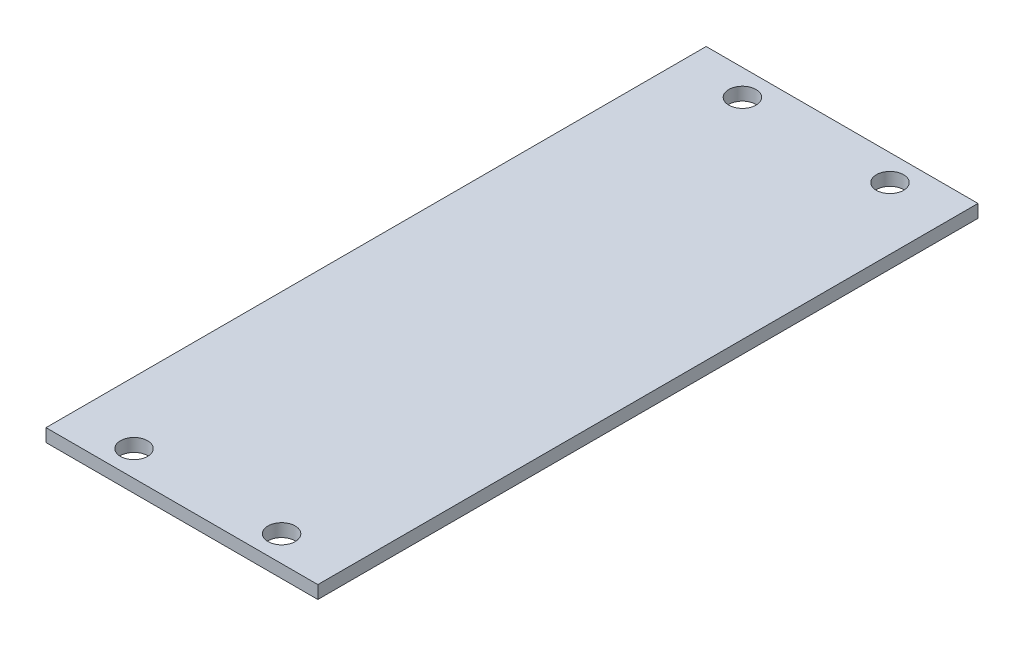
from build123d import *

# Parameters (mm, degrees)
SKETCH1_W               = 21
SKETCH1_H               = 51
BOSS_EXTRUDE1_DEPTH     = 1
SKETCH3_R               = 1.05
CUT_EXTRUDE2_DEPTH      = 28.595289453
MIRROR2_COPY_1_SKETCH_R = 1.05
MIRROR2_COPY_1_DEPTH    = 28.595289453


with BuildPart() as part:
    # Sketch1 → Boss-Extrude1 (new body)
    with BuildSketch(Plane(origin=(0, 0, 0), x_dir=(1, 0, 0), z_dir=(0, 1, 0))):
        Rectangle(SKETCH1_W, SKETCH1_H)
    extrude(amount=BOSS_EXTRUDE1_DEPTH)

    # Sketch3 → Cut-Extrude2 (cut, through all)
    with BuildSketch(Plane(origin=(0, 1, 0), x_dir=(1, 0, 0), z_dir=(0, 1, 0))):
        with Locations(Location((-5.7, 23.5, 0), (0, 0, 270))):
            Circle(SKETCH3_R)
    cut_extrude2 = extrude(amount=-CUT_EXTRUDE2_DEPTH, mode=Mode.SUBTRACT)

    # Mirror1: Cut-Extrude2 across plane
    add(cut_extrude2.mirror(Plane(origin=(0, 0, 0), x_dir=(0, 0, 1), z_dir=(1, 0, 0))), mode=Mode.SUBTRACT)

    # Mirror2: Cut-Extrude2 across plane
    add(cut_extrude2.mirror(Plane.XY), mode=Mode.SUBTRACT)

    # Mirror2 copy 1 sketch → Mirror2 copy 1 (cut, through all)
    with BuildSketch(Plane(origin=(0, 1, 0), x_dir=(-1, 0, 0), z_dir=(0, 1, 0))):
        with Locations(Location((-5.7, 23.5, 0), (0, 0, 270))):
            Circle(MIRROR2_COPY_1_SKETCH_R)
    extrude(amount=-MIRROR2_COPY_1_DEPTH, mode=Mode.SUBTRACT)


solid = part.part
